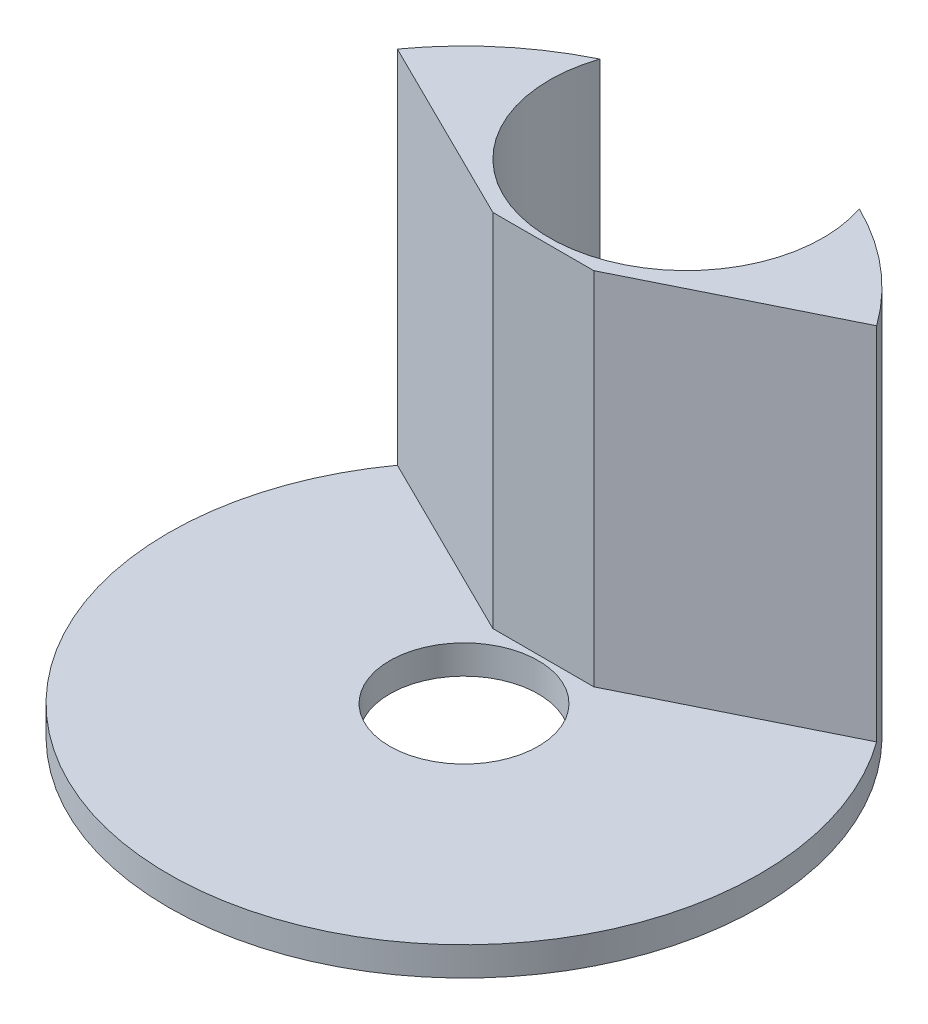
from build123d import *

# Parameters (mm, degrees)
SKETCH1_R           = 20.5
BOSS_EXTRUDE1_DEPTH = 2
SKETCH2_R           = 5.15
CUT_EXTRUDE1_DEPTH  = 3
SKETCH3_R           = 6.5
CUT_EXTRUDE2_DEPTH  = 2
BOSS_EXTRUDE4_DEPTH = 25


with BuildPart() as part:
    # Sketch1 → Boss-Extrude1 (new body)
    with BuildSketch(Plane(origin=(0, 0, 0), x_dir=(1, 0, 0), z_dir=(0, 1, 0))):
        with Locations(Location((0, 0, 0), (0, 0, 270))):
            Circle(SKETCH1_R)
    extrude(amount=BOSS_EXTRUDE1_DEPTH)

    # Sketch2 → Cut-Extrude1 (cut)
    with BuildSketch(Plane(origin=(0, 2, 0), x_dir=(1, 0, 0), z_dir=(0, 1, 0))):
        with Locations(Location((0, 0, 0), (0, 0, 270))):
            Circle(SKETCH2_R)
    extrude(amount=-CUT_EXTRUDE1_DEPTH, mode=Mode.SUBTRACT)

    # Sketch3 → Cut-Extrude2 (cut)
    with BuildSketch(Plane(origin=(0, 2, 0), x_dir=(1, 0, 0), z_dir=(0, 1, 0))):
        with Locations(Location((0, 13, 0), (0, 0, 270))):
            Circle(SKETCH3_R)
    extrude(amount=-CUT_EXTRUDE2_DEPTH, mode=Mode.SUBTRACT)

    # Sketch4 → Boss-Extrude4 (add)
    with BuildSketch(Plane(origin=(0, 2, 0), x_dir=(1, 0, 0), z_dir=(0, 1, 0))):
        with BuildLine():
            Line((-16.620770139, 12), (-3.5, 5.5))
            Line((-3.5, 5.5), (3.5, 5.5))
            Line((3.5, 5.5), (16.620770139, 12))
            ThreePointArc((16.620770139, 12), (13.206287248, 15.679412525), (9, 18.418740456))
            ThreePointArc((9, 18.418740456), (0, 5.93152382), (-9, 18.418740456))
            ThreePointArc((-9, 18.418740456), (-13.206287248, 15.679412525), (-16.620770139, 12))
        make_face()
    extrude(amount=BOSS_EXTRUDE4_DEPTH)


solid = part.part
